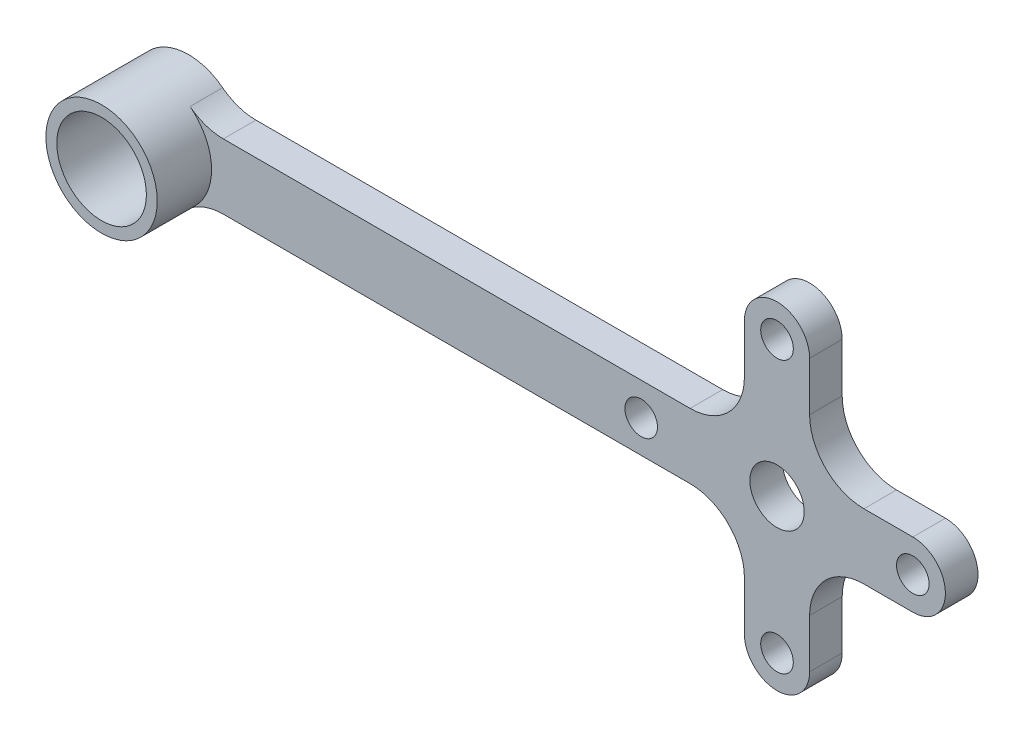
from build123d import *

# Parameters (mm, degrees)
ESBO_O1_R                            = 2.5
ESBO_O1_R_2                          = 1.5
RESSALTO_EXTRUS_O3_DEPTH             = 1.5
ESBO_O2_R                            = 5.125
RESSALTO_EXTRUS_O4_DEPTH             = 5
RESSALTO_EXTRUS_O4_DIRECTION_2_REACH = 64.207
ESBO_O3_R                            = 4.125
CORTE_EXTRUS_O1_DEPTH                = 10
FILETE1_R                            = 5


with BuildPart() as part:
    # Esboço1 → Ressalto-extrusão3 (new, symmetric)
    with BuildSketch(Plane.XY):
        with BuildLine():
            Line((3, -3), (12.5, -3))
            ThreePointArc((12.5, -3), (15.5, 0), (12.5, 3))
            Line((12.5, 3), (3, 3))
            Line((3, 3), (3, 12.5))
            ThreePointArc((3, 12.5), (0, 15.5), (-3, 12.5))
            Line((-3, 12.5), (-3, 3))
            Line((-3, 3), (-57.17, 3))
            ThreePointArc((-57.17, 3), (-60.17, 0), (-57.17, -3))
            Line((-57.17, -3), (-3, -3))
            Line((-3, -3), (-3, -12.5))
            ThreePointArc((-3, -12.5), (0, -15.5), (3, -12.5))
            Line((3, -12.5), (3, -3))
        make_face()
        Circle(ESBO_O1_R, mode=Mode.SUBTRACT)
        with Locations((-12.5, 0)):
            Circle(ESBO_O1_R_2, mode=Mode.SUBTRACT)
        with Locations((0, 12.5)):
            Circle(ESBO_O1_R_2, mode=Mode.SUBTRACT)
        with Locations((12.5, 0)):
            Circle(ESBO_O1_R_2, mode=Mode.SUBTRACT)
        with Locations((0, -12.5)):
            Circle(ESBO_O1_R_2, mode=Mode.SUBTRACT)
    extrude(amount=RESSALTO_EXTRUS_O3_DEPTH, both=True)

    # Esboço2 → Ressalto-extrusão4 (add)
    with BuildSketch(Plane.XY.offset(1.5)):
        with Locations((-57.17, 0)):
            Circle(ESBO_O2_R)
    extrude(amount=RESSALTO_EXTRUS_O4_DEPTH)

    # Ressalto-extrusão4 direction 2: up to this face of the body (flat: up to its plane)
    ressalto_extrus_o4_direction_2_end = Plane(part.part.faces().sort_by_distance((-18.436716942, 0, -1.5))[0])
    # Esboço2 → Ressalto-extrusão4 direction 2 (add, up to the picked face)
    with BuildSketch(Plane.XY.offset(1.5), mode=Mode.PRIVATE) as ressalto_extrus_o4_direction_2_sk1:
        with Locations((-57.17, 0)):
            Circle(ESBO_O2_R)
    ressalto_extrus_o4_direction_2_tool1 = split(extrude(ressalto_extrus_o4_direction_2_sk1.sketch, amount=-RESSALTO_EXTRUS_O4_DIRECTION_2_REACH, mode=Mode.PRIVATE), bisect_by=ressalto_extrus_o4_direction_2_end, keep=Keep.BOTH, mode=Mode.PRIVATE)
    add(ressalto_extrus_o4_direction_2_tool1.solids().sort_by(Axis((-57.17, 0, 1.5), (0, 0, -1)))[0])

    # Esboço3 → Corte-extrusão1 (cut)
    with BuildSketch(Plane.XY.offset(6.5)):
        with Locations((-57.17, 0)):
            Circle(ESBO_O3_R)
    extrude(amount=-CORTE_EXTRUS_O1_DEPTH, mode=Mode.SUBTRACT)

    # Filete1
    filete1_edges = [part.edges().sort_by_distance(p)[0] for p in [
        (3, -3, 0),
        (-3, -3, 0),
        (-3, 3, 0),
        (3, 3, 0),
        (-53.014807465, -3, 0),
        (-53.014807465, 3, 0),
    ]]
    fillet(filete1_edges, radius=FILETE1_R)


solid = part.part
